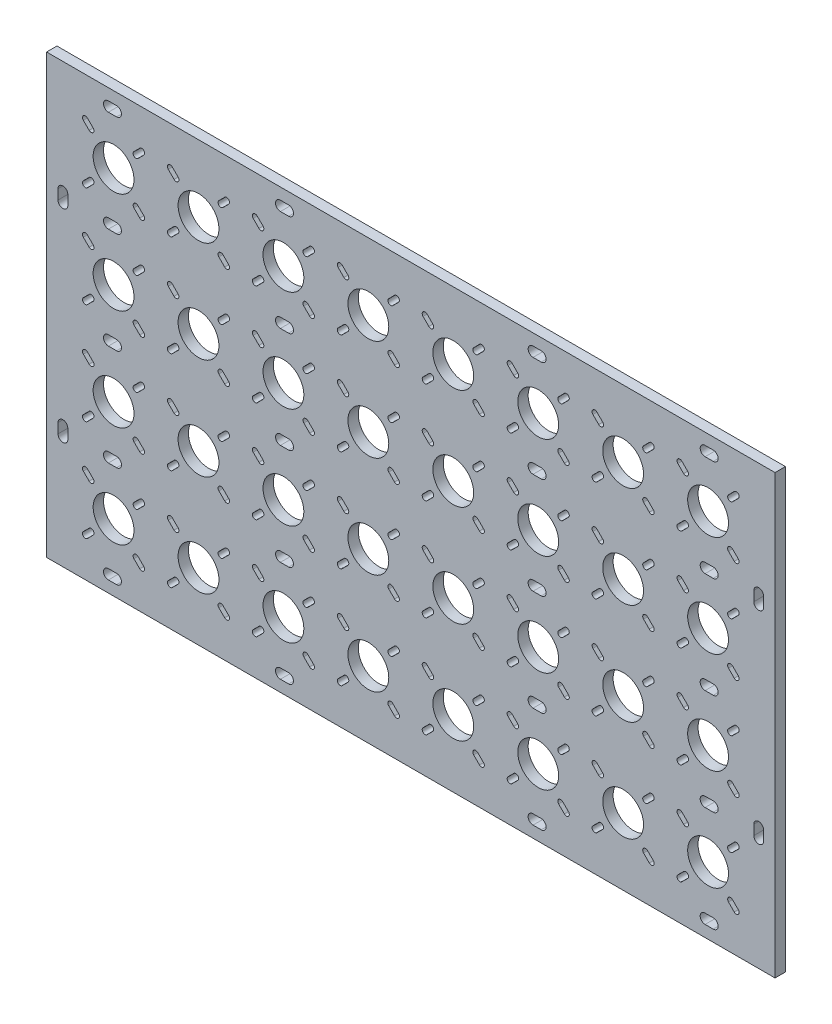
from build123d import *

# Parameters (mm, degrees)
SKETCH1_W           = 446
SKETCH1_H           = 268
SKETCH1_R           = 12.5
BOSS_EXTRUDE1_DEPTH = 6.35


with BuildPart() as part:
    # Sketch1 → Boss-Extrude1 (new body)
    with BuildSketch(Plane.XY):
        Rectangle(SKETCH1_W, SKETCH1_H)
        with Locations((-182, 93)):
            Circle(SKETCH1_R, mode=Mode.SUBTRACT)
        with Locations((-130, 93)):
            Circle(SKETCH1_R, mode=Mode.SUBTRACT)
        with Locations((-78, 93)):
            Circle(SKETCH1_R, mode=Mode.SUBTRACT)
        with Locations((-26, 93)):
            Circle(SKETCH1_R, mode=Mode.SUBTRACT)
        with Locations((26, 93)):
            Circle(SKETCH1_R, mode=Mode.SUBTRACT)
        with Locations((78, 93)):
            Circle(SKETCH1_R, mode=Mode.SUBTRACT)
        with Locations((130, 93)):
            Circle(SKETCH1_R, mode=Mode.SUBTRACT)
        with Locations((182, 93)):
            Circle(SKETCH1_R, mode=Mode.SUBTRACT)
        with Locations((-130, 31)):
            Circle(SKETCH1_R, mode=Mode.SUBTRACT)
        with Locations((-78, 31)):
            Circle(SKETCH1_R, mode=Mode.SUBTRACT)
        with Locations((-26, 31)):
            Circle(SKETCH1_R, mode=Mode.SUBTRACT)
        with Locations((26, 31)):
            Circle(SKETCH1_R, mode=Mode.SUBTRACT)
        with Locations((78, 31)):
            Circle(SKETCH1_R, mode=Mode.SUBTRACT)
        with Locations((130, 31)):
            Circle(SKETCH1_R, mode=Mode.SUBTRACT)
        with Locations((182, 31)):
            Circle(SKETCH1_R, mode=Mode.SUBTRACT)
        with Locations((-130, -31)):
            Circle(SKETCH1_R, mode=Mode.SUBTRACT)
        with Locations((-78, -31)):
            Circle(SKETCH1_R, mode=Mode.SUBTRACT)
        with Locations((-26, -31)):
            Circle(SKETCH1_R, mode=Mode.SUBTRACT)
        with Locations((26, -31)):
            Circle(SKETCH1_R, mode=Mode.SUBTRACT)
        with Locations((78, -31)):
            Circle(SKETCH1_R, mode=Mode.SUBTRACT)
        with Locations((130, -31)):
            Circle(SKETCH1_R, mode=Mode.SUBTRACT)
        with Locations((182, -31)):
            Circle(SKETCH1_R, mode=Mode.SUBTRACT)
        with Locations((-130, -93)):
            Circle(SKETCH1_R, mode=Mode.SUBTRACT)
        with Locations((-78, -93)):
            Circle(SKETCH1_R, mode=Mode.SUBTRACT)
        with Locations((-26, -93)):
            Circle(SKETCH1_R, mode=Mode.SUBTRACT)
        with Locations((26, -93)):
            Circle(SKETCH1_R, mode=Mode.SUBTRACT)
        with Locations((78, -93)):
            Circle(SKETCH1_R, mode=Mode.SUBTRACT)
        with Locations((130, -93)):
            Circle(SKETCH1_R, mode=Mode.SUBTRACT)
        with Locations((182, -93)):
            Circle(SKETCH1_R, mode=Mode.SUBTRACT)
        with Locations((-182, 31)):
            Circle(SKETCH1_R, mode=Mode.SUBTRACT)
        with Locations((-182, -31)):
            Circle(SKETCH1_R, mode=Mode.SUBTRACT)
        with Locations((-182, -93)):
            Circle(SKETCH1_R, mode=Mode.SUBTRACT)
        with BuildLine():
            Line((-198.030330086, 111.50520382), (-194.49479618, 107.969669914))
            ThreePointArc((-194.49479618, 107.969669914), (-194.49479618, 105.49479618), (-196.969669914, 105.49479618))
            Line((-196.969669914, 105.49479618), (-200.50520382, 109.030330086))
            ThreePointArc((-200.50520382, 109.030330086), (-200.50520382, 111.50520382), (-198.030330086, 111.50520382))
        make_face(mode=Mode.SUBTRACT)
        with BuildLine():
            Line((-163.49479618, 109.030330086), (-167.030330086, 105.49479618))
            ThreePointArc((-167.030330086, 105.49479618), (-169.50520382, 105.49479618), (-169.50520382, 107.969669914))
            Line((-169.50520382, 107.969669914), (-165.969669914, 111.50520382))
            ThreePointArc((-165.969669914, 111.50520382), (-163.49479618, 111.50520382), (-163.49479618, 109.030330086))
        make_face(mode=Mode.SUBTRACT)
        with BuildLine():
            Line((-165.969669914, 74.49479618), (-169.50520382, 78.030330086))
            ThreePointArc((-169.50520382, 78.030330086), (-169.50520382, 80.50520382), (-167.030330086, 80.50520382))
            Line((-167.030330086, 80.50520382), (-163.49479618, 76.969669914))
            ThreePointArc((-163.49479618, 76.969669914), (-163.49479618, 74.49479618), (-165.969669914, 74.49479618))
        make_face(mode=Mode.SUBTRACT)
        with BuildLine():
            Line((-200.50520382, 76.969669914), (-196.969669914, 80.50520382))
            ThreePointArc((-196.969669914, 80.50520382), (-194.49479618, 80.50520382), (-194.49479618, 78.030330086))
            Line((-194.49479618, 78.030330086), (-198.030330086, 74.49479618))
            ThreePointArc((-198.030330086, 74.49479618), (-200.50520382, 74.49479618), (-200.50520382, 76.969669914))
        make_face(mode=Mode.SUBTRACT)
        with BuildLine():
            Line((-146.030330086, 111.50520382), (-142.49479618, 107.969669914))
            ThreePointArc((-142.49479618, 107.969669914), (-142.49479618, 105.49479618), (-144.969669914, 105.49479618))
            Line((-144.969669914, 105.49479618), (-148.50520382, 109.030330086))
            ThreePointArc((-148.50520382, 109.030330086), (-148.50520382, 111.50520382), (-146.030330086, 111.50520382))
        make_face(mode=Mode.SUBTRACT)
        with BuildLine():
            Line((-111.49479618, 109.030330086), (-115.030330086, 105.49479618))
            ThreePointArc((-115.030330086, 105.49479618), (-117.50520382, 105.49479618), (-117.50520382, 107.969669914))
            Line((-117.50520382, 107.969669914), (-113.969669914, 111.50520382))
            ThreePointArc((-113.969669914, 111.50520382), (-111.49479618, 111.50520382), (-111.49479618, 109.030330086))
        make_face(mode=Mode.SUBTRACT)
        with BuildLine():
            Line((-113.969669914, 74.49479618), (-117.50520382, 78.030330086))
            ThreePointArc((-117.50520382, 78.030330086), (-117.50520382, 80.50520382), (-115.030330086, 80.50520382))
            Line((-115.030330086, 80.50520382), (-111.49479618, 76.969669914))
            ThreePointArc((-111.49479618, 76.969669914), (-111.49479618, 74.49479618), (-113.969669914, 74.49479618))
        make_face(mode=Mode.SUBTRACT)
        with BuildLine():
            Line((-148.50520382, 76.969669914), (-144.969669914, 80.50520382))
            ThreePointArc((-144.969669914, 80.50520382), (-142.49479618, 80.50520382), (-142.49479618, 78.030330086))
            Line((-142.49479618, 78.030330086), (-146.030330086, 74.49479618))
            ThreePointArc((-146.030330086, 74.49479618), (-148.50520382, 74.49479618), (-148.50520382, 76.969669914))
        make_face(mode=Mode.SUBTRACT)
        with BuildLine():
            Line((-94.030330086, 111.50520382), (-90.49479618, 107.969669914))
            ThreePointArc((-90.49479618, 107.969669914), (-90.49479618, 105.49479618), (-92.969669914, 105.49479618))
            Line((-92.969669914, 105.49479618), (-96.50520382, 109.030330086))
            ThreePointArc((-96.50520382, 109.030330086), (-96.50520382, 111.50520382), (-94.030330086, 111.50520382))
        make_face(mode=Mode.SUBTRACT)
        with BuildLine():
            Line((-59.49479618, 109.030330086), (-63.030330086, 105.49479618))
            ThreePointArc((-63.030330086, 105.49479618), (-65.50520382, 105.49479618), (-65.50520382, 107.969669914))
            Line((-65.50520382, 107.969669914), (-61.969669914, 111.50520382))
            ThreePointArc((-61.969669914, 111.50520382), (-59.49479618, 111.50520382), (-59.49479618, 109.030330086))
        make_face(mode=Mode.SUBTRACT)
        with BuildLine():
            Line((-61.969669914, 74.49479618), (-65.50520382, 78.030330086))
            ThreePointArc((-65.50520382, 78.030330086), (-65.50520382, 80.50520382), (-63.030330086, 80.50520382))
            Line((-63.030330086, 80.50520382), (-59.49479618, 76.969669914))
            ThreePointArc((-59.49479618, 76.969669914), (-59.49479618, 74.49479618), (-61.969669914, 74.49479618))
        make_face(mode=Mode.SUBTRACT)
        with BuildLine():
            Line((-96.50520382, 76.969669914), (-92.969669914, 80.50520382))
            ThreePointArc((-92.969669914, 80.50520382), (-90.49479618, 80.50520382), (-90.49479618, 78.030330086))
            Line((-90.49479618, 78.030330086), (-94.030330086, 74.49479618))
            ThreePointArc((-94.030330086, 74.49479618), (-96.50520382, 74.49479618), (-96.50520382, 76.969669914))
        make_face(mode=Mode.SUBTRACT)
        with BuildLine():
            Line((-42.030330086, 111.50520382), (-38.49479618, 107.969669914))
            ThreePointArc((-38.49479618, 107.969669914), (-38.49479618, 105.49479618), (-40.969669914, 105.49479618))
            Line((-40.969669914, 105.49479618), (-44.50520382, 109.030330086))
            ThreePointArc((-44.50520382, 109.030330086), (-44.50520382, 111.50520382), (-42.030330086, 111.50520382))
        make_face(mode=Mode.SUBTRACT)
        with BuildLine():
            Line((-7.49479618, 109.030330086), (-11.030330086, 105.49479618))
            ThreePointArc((-11.030330086, 105.49479618), (-13.50520382, 105.49479618), (-13.50520382, 107.969669914))
            Line((-13.50520382, 107.969669914), (-9.969669914, 111.50520382))
            ThreePointArc((-9.969669914, 111.50520382), (-7.49479618, 111.50520382), (-7.49479618, 109.030330086))
        make_face(mode=Mode.SUBTRACT)
        with BuildLine():
            Line((-9.969669914, 74.49479618), (-13.50520382, 78.030330086))
            ThreePointArc((-13.50520382, 78.030330086), (-13.50520382, 80.50520382), (-11.030330086, 80.50520382))
            Line((-11.030330086, 80.50520382), (-7.49479618, 76.969669914))
            ThreePointArc((-7.49479618, 76.969669914), (-7.49479618, 74.49479618), (-9.969669914, 74.49479618))
        make_face(mode=Mode.SUBTRACT)
        with BuildLine():
            Line((-44.50520382, 76.969669914), (-40.969669914, 80.50520382))
            ThreePointArc((-40.969669914, 80.50520382), (-38.49479618, 80.50520382), (-38.49479618, 78.030330086))
            Line((-38.49479618, 78.030330086), (-42.030330086, 74.49479618))
            ThreePointArc((-42.030330086, 74.49479618), (-44.50520382, 74.49479618), (-44.50520382, 76.969669914))
        make_face(mode=Mode.SUBTRACT)
        with BuildLine():
            Line((9.969669914, 111.50520382), (13.50520382, 107.969669914))
            ThreePointArc((13.50520382, 107.969669914), (13.50520382, 105.49479618), (11.030330086, 105.49479618))
            Line((11.030330086, 105.49479618), (7.49479618, 109.030330086))
            ThreePointArc((7.49479618, 109.030330086), (7.49479618, 111.50520382), (9.969669914, 111.50520382))
        make_face(mode=Mode.SUBTRACT)
        with BuildLine():
            Line((44.50520382, 109.030330086), (40.969669914, 105.49479618))
            ThreePointArc((40.969669914, 105.49479618), (38.49479618, 105.49479618), (38.49479618, 107.969669914))
            Line((38.49479618, 107.969669914), (42.030330086, 111.50520382))
            ThreePointArc((42.030330086, 111.50520382), (44.50520382, 111.50520382), (44.50520382, 109.030330086))
        make_face(mode=Mode.SUBTRACT)
        with BuildLine():
            Line((42.030330086, 74.49479618), (38.49479618, 78.030330086))
            ThreePointArc((38.49479618, 78.030330086), (38.49479618, 80.50520382), (40.969669914, 80.50520382))
            Line((40.969669914, 80.50520382), (44.50520382, 76.969669914))
            ThreePointArc((44.50520382, 76.969669914), (44.50520382, 74.49479618), (42.030330086, 74.49479618))
        make_face(mode=Mode.SUBTRACT)
        with BuildLine():
            Line((7.49479618, 76.969669914), (11.030330086, 80.50520382))
            ThreePointArc((11.030330086, 80.50520382), (13.50520382, 80.50520382), (13.50520382, 78.030330086))
            Line((13.50520382, 78.030330086), (9.969669914, 74.49479618))
            ThreePointArc((9.969669914, 74.49479618), (7.49479618, 74.49479618), (7.49479618, 76.969669914))
        make_face(mode=Mode.SUBTRACT)
        with BuildLine():
            Line((61.969669914, 111.50520382), (65.50520382, 107.969669914))
            ThreePointArc((65.50520382, 107.969669914), (65.50520382, 105.49479618), (63.030330086, 105.49479618))
            Line((63.030330086, 105.49479618), (59.49479618, 109.030330086))
            ThreePointArc((59.49479618, 109.030330086), (59.49479618, 111.50520382), (61.969669914, 111.50520382))
        make_face(mode=Mode.SUBTRACT)
        with BuildLine():
            Line((96.50520382, 109.030330086), (92.969669914, 105.49479618))
            ThreePointArc((92.969669914, 105.49479618), (90.49479618, 105.49479618), (90.49479618, 107.969669914))
            Line((90.49479618, 107.969669914), (94.030330086, 111.50520382))
            ThreePointArc((94.030330086, 111.50520382), (96.50520382, 111.50520382), (96.50520382, 109.030330086))
        make_face(mode=Mode.SUBTRACT)
        with BuildLine():
            Line((94.030330086, 74.49479618), (90.49479618, 78.030330086))
            ThreePointArc((90.49479618, 78.030330086), (90.49479618, 80.50520382), (92.969669914, 80.50520382))
            Line((92.969669914, 80.50520382), (96.50520382, 76.969669914))
            ThreePointArc((96.50520382, 76.969669914), (96.50520382, 74.49479618), (94.030330086, 74.49479618))
        make_face(mode=Mode.SUBTRACT)
        with BuildLine():
            Line((59.49479618, 76.969669914), (63.030330086, 80.50520382))
            ThreePointArc((63.030330086, 80.50520382), (65.50520382, 80.50520382), (65.50520382, 78.030330086))
            Line((65.50520382, 78.030330086), (61.969669914, 74.49479618))
            ThreePointArc((61.969669914, 74.49479618), (59.49479618, 74.49479618), (59.49479618, 76.969669914))
        make_face(mode=Mode.SUBTRACT)
        with BuildLine():
            Line((113.969669914, 111.50520382), (117.50520382, 107.969669914))
            ThreePointArc((117.50520382, 107.969669914), (117.50520382, 105.49479618), (115.030330086, 105.49479618))
            Line((115.030330086, 105.49479618), (111.49479618, 109.030330086))
            ThreePointArc((111.49479618, 109.030330086), (111.49479618, 111.50520382), (113.969669914, 111.50520382))
        make_face(mode=Mode.SUBTRACT)
        with BuildLine():
            Line((148.50520382, 109.030330086), (144.969669914, 105.49479618))
            ThreePointArc((144.969669914, 105.49479618), (142.49479618, 105.49479618), (142.49479618, 107.969669914))
            Line((142.49479618, 107.969669914), (146.030330086, 111.50520382))
            ThreePointArc((146.030330086, 111.50520382), (148.50520382, 111.50520382), (148.50520382, 109.030330086))
        make_face(mode=Mode.SUBTRACT)
        with BuildLine():
            Line((146.030330086, 74.49479618), (142.49479618, 78.030330086))
            ThreePointArc((142.49479618, 78.030330086), (142.49479618, 80.50520382), (144.969669914, 80.50520382))
            Line((144.969669914, 80.50520382), (148.50520382, 76.969669914))
            ThreePointArc((148.50520382, 76.969669914), (148.50520382, 74.49479618), (146.030330086, 74.49479618))
        make_face(mode=Mode.SUBTRACT)
        with BuildLine():
            Line((111.49479618, 76.969669914), (115.030330086, 80.50520382))
            ThreePointArc((115.030330086, 80.50520382), (117.50520382, 80.50520382), (117.50520382, 78.030330086))
            Line((117.50520382, 78.030330086), (113.969669914, 74.49479618))
            ThreePointArc((113.969669914, 74.49479618), (111.49479618, 74.49479618), (111.49479618, 76.969669914))
        make_face(mode=Mode.SUBTRACT)
        with BuildLine():
            Line((165.969669914, 111.50520382), (169.50520382, 107.969669914))
            ThreePointArc((169.50520382, 107.969669914), (169.50520382, 105.49479618), (167.030330086, 105.49479618))
            Line((167.030330086, 105.49479618), (163.49479618, 109.030330086))
            ThreePointArc((163.49479618, 109.030330086), (163.49479618, 111.50520382), (165.969669914, 111.50520382))
        make_face(mode=Mode.SUBTRACT)
        with BuildLine():
            Line((200.50520382, 109.030330086), (196.969669914, 105.49479618))
            ThreePointArc((196.969669914, 105.49479618), (194.49479618, 105.49479618), (194.49479618, 107.969669914))
            Line((194.49479618, 107.969669914), (198.030330086, 111.50520382))
            ThreePointArc((198.030330086, 111.50520382), (200.50520382, 111.50520382), (200.50520382, 109.030330086))
        make_face(mode=Mode.SUBTRACT)
        with BuildLine():
            Line((198.030330086, 74.49479618), (194.49479618, 78.030330086))
            ThreePointArc((194.49479618, 78.030330086), (194.49479618, 80.50520382), (196.969669914, 80.50520382))
            Line((196.969669914, 80.50520382), (200.50520382, 76.969669914))
            ThreePointArc((200.50520382, 76.969669914), (200.50520382, 74.49479618), (198.030330086, 74.49479618))
        make_face(mode=Mode.SUBTRACT)
        with BuildLine():
            Line((163.49479618, 76.969669914), (167.030330086, 80.50520382))
            ThreePointArc((167.030330086, 80.50520382), (169.50520382, 80.50520382), (169.50520382, 78.030330086))
            Line((169.50520382, 78.030330086), (165.969669914, 74.49479618))
            ThreePointArc((165.969669914, 74.49479618), (163.49479618, 74.49479618), (163.49479618, 76.969669914))
        make_face(mode=Mode.SUBTRACT)
        with BuildLine():
            Line((-146.030330086, 49.50520382), (-142.49479618, 45.969669914))
            ThreePointArc((-142.49479618, 45.969669914), (-142.49479618, 43.49479618), (-144.969669914, 43.49479618))
            Line((-144.969669914, 43.49479618), (-148.50520382, 47.030330086))
            ThreePointArc((-148.50520382, 47.030330086), (-148.50520382, 49.50520382), (-146.030330086, 49.50520382))
        make_face(mode=Mode.SUBTRACT)
        with BuildLine():
            Line((-111.49479618, 47.030330086), (-115.030330086, 43.49479618))
            ThreePointArc((-115.030330086, 43.49479618), (-117.50520382, 43.49479618), (-117.50520382, 45.969669914))
            Line((-117.50520382, 45.969669914), (-113.969669914, 49.50520382))
            ThreePointArc((-113.969669914, 49.50520382), (-111.49479618, 49.50520382), (-111.49479618, 47.030330086))
        make_face(mode=Mode.SUBTRACT)
        with BuildLine():
            Line((-113.969669914, 12.49479618), (-117.50520382, 16.030330086))
            ThreePointArc((-117.50520382, 16.030330086), (-117.50520382, 18.50520382), (-115.030330086, 18.50520382))
            Line((-115.030330086, 18.50520382), (-111.49479618, 14.969669914))
            ThreePointArc((-111.49479618, 14.969669914), (-111.49479618, 12.49479618), (-113.969669914, 12.49479618))
        make_face(mode=Mode.SUBTRACT)
        with BuildLine():
            Line((-148.50520382, 14.969669914), (-144.969669914, 18.50520382))
            ThreePointArc((-144.969669914, 18.50520382), (-142.49479618, 18.50520382), (-142.49479618, 16.030330086))
            Line((-142.49479618, 16.030330086), (-146.030330086, 12.49479618))
            ThreePointArc((-146.030330086, 12.49479618), (-148.50520382, 12.49479618), (-148.50520382, 14.969669914))
        make_face(mode=Mode.SUBTRACT)
        with BuildLine():
            Line((-94.030330086, 49.50520382), (-90.49479618, 45.969669914))
            ThreePointArc((-90.49479618, 45.969669914), (-90.49479618, 43.49479618), (-92.969669914, 43.49479618))
            Line((-92.969669914, 43.49479618), (-96.50520382, 47.030330086))
            ThreePointArc((-96.50520382, 47.030330086), (-96.50520382, 49.50520382), (-94.030330086, 49.50520382))
        make_face(mode=Mode.SUBTRACT)
        with BuildLine():
            Line((-59.49479618, 47.030330086), (-63.030330086, 43.49479618))
            ThreePointArc((-63.030330086, 43.49479618), (-65.50520382, 43.49479618), (-65.50520382, 45.969669914))
            Line((-65.50520382, 45.969669914), (-61.969669914, 49.50520382))
            ThreePointArc((-61.969669914, 49.50520382), (-59.49479618, 49.50520382), (-59.49479618, 47.030330086))
        make_face(mode=Mode.SUBTRACT)
        with BuildLine():
            Line((-61.969669914, 12.49479618), (-65.50520382, 16.030330086))
            ThreePointArc((-65.50520382, 16.030330086), (-65.50520382, 18.50520382), (-63.030330086, 18.50520382))
            Line((-63.030330086, 18.50520382), (-59.49479618, 14.969669914))
            ThreePointArc((-59.49479618, 14.969669914), (-59.49479618, 12.49479618), (-61.969669914, 12.49479618))
        make_face(mode=Mode.SUBTRACT)
        with BuildLine():
            Line((-96.50520382, 14.969669914), (-92.969669914, 18.50520382))
            ThreePointArc((-92.969669914, 18.50520382), (-90.49479618, 18.50520382), (-90.49479618, 16.030330086))
            Line((-90.49479618, 16.030330086), (-94.030330086, 12.49479618))
            ThreePointArc((-94.030330086, 12.49479618), (-96.50520382, 12.49479618), (-96.50520382, 14.969669914))
        make_face(mode=Mode.SUBTRACT)
        with BuildLine():
            Line((-42.030330086, 49.50520382), (-38.49479618, 45.969669914))
            ThreePointArc((-38.49479618, 45.969669914), (-38.49479618, 43.49479618), (-40.969669914, 43.49479618))
            Line((-40.969669914, 43.49479618), (-44.50520382, 47.030330086))
            ThreePointArc((-44.50520382, 47.030330086), (-44.50520382, 49.50520382), (-42.030330086, 49.50520382))
        make_face(mode=Mode.SUBTRACT)
        with BuildLine():
            Line((-7.49479618, 47.030330086), (-11.030330086, 43.49479618))
            ThreePointArc((-11.030330086, 43.49479618), (-13.50520382, 43.49479618), (-13.50520382, 45.969669914))
            Line((-13.50520382, 45.969669914), (-9.969669914, 49.50520382))
            ThreePointArc((-9.969669914, 49.50520382), (-7.49479618, 49.50520382), (-7.49479618, 47.030330086))
        make_face(mode=Mode.SUBTRACT)
        with BuildLine():
            Line((-9.969669914, 12.49479618), (-13.50520382, 16.030330086))
            ThreePointArc((-13.50520382, 16.030330086), (-13.50520382, 18.50520382), (-11.030330086, 18.50520382))
            Line((-11.030330086, 18.50520382), (-7.49479618, 14.969669914))
            ThreePointArc((-7.49479618, 14.969669914), (-7.49479618, 12.49479618), (-9.969669914, 12.49479618))
        make_face(mode=Mode.SUBTRACT)
        with BuildLine():
            Line((-44.50520382, 14.969669914), (-40.969669914, 18.50520382))
            ThreePointArc((-40.969669914, 18.50520382), (-38.49479618, 18.50520382), (-38.49479618, 16.030330086))
            Line((-38.49479618, 16.030330086), (-42.030330086, 12.49479618))
            ThreePointArc((-42.030330086, 12.49479618), (-44.50520382, 12.49479618), (-44.50520382, 14.969669914))
        make_face(mode=Mode.SUBTRACT)
        with BuildLine():
            Line((9.969669914, 49.50520382), (13.50520382, 45.969669914))
            ThreePointArc((13.50520382, 45.969669914), (13.50520382, 43.49479618), (11.030330086, 43.49479618))
            Line((11.030330086, 43.49479618), (7.49479618, 47.030330086))
            ThreePointArc((7.49479618, 47.030330086), (7.49479618, 49.50520382), (9.969669914, 49.50520382))
        make_face(mode=Mode.SUBTRACT)
        with BuildLine():
            Line((44.50520382, 47.030330086), (40.969669914, 43.49479618))
            ThreePointArc((40.969669914, 43.49479618), (38.49479618, 43.49479618), (38.49479618, 45.969669914))
            Line((38.49479618, 45.969669914), (42.030330086, 49.50520382))
            ThreePointArc((42.030330086, 49.50520382), (44.50520382, 49.50520382), (44.50520382, 47.030330086))
        make_face(mode=Mode.SUBTRACT)
        with BuildLine():
            Line((42.030330086, 12.49479618), (38.49479618, 16.030330086))
            ThreePointArc((38.49479618, 16.030330086), (38.49479618, 18.50520382), (40.969669914, 18.50520382))
            Line((40.969669914, 18.50520382), (44.50520382, 14.969669914))
            ThreePointArc((44.50520382, 14.969669914), (44.50520382, 12.49479618), (42.030330086, 12.49479618))
        make_face(mode=Mode.SUBTRACT)
        with BuildLine():
            Line((7.49479618, 14.969669914), (11.030330086, 18.50520382))
            ThreePointArc((11.030330086, 18.50520382), (13.50520382, 18.50520382), (13.50520382, 16.030330086))
            Line((13.50520382, 16.030330086), (9.969669914, 12.49479618))
            ThreePointArc((9.969669914, 12.49479618), (7.49479618, 12.49479618), (7.49479618, 14.969669914))
        make_face(mode=Mode.SUBTRACT)
        with BuildLine():
            Line((61.969669914, 49.50520382), (65.50520382, 45.969669914))
            ThreePointArc((65.50520382, 45.969669914), (65.50520382, 43.49479618), (63.030330086, 43.49479618))
            Line((63.030330086, 43.49479618), (59.49479618, 47.030330086))
            ThreePointArc((59.49479618, 47.030330086), (59.49479618, 49.50520382), (61.969669914, 49.50520382))
        make_face(mode=Mode.SUBTRACT)
        with BuildLine():
            Line((96.50520382, 47.030330086), (92.969669914, 43.49479618))
            ThreePointArc((92.969669914, 43.49479618), (90.49479618, 43.49479618), (90.49479618, 45.969669914))
            Line((90.49479618, 45.969669914), (94.030330086, 49.50520382))
            ThreePointArc((94.030330086, 49.50520382), (96.50520382, 49.50520382), (96.50520382, 47.030330086))
        make_face(mode=Mode.SUBTRACT)
        with BuildLine():
            Line((94.030330086, 12.49479618), (90.49479618, 16.030330086))
            ThreePointArc((90.49479618, 16.030330086), (90.49479618, 18.50520382), (92.969669914, 18.50520382))
            Line((92.969669914, 18.50520382), (96.50520382, 14.969669914))
            ThreePointArc((96.50520382, 14.969669914), (96.50520382, 12.49479618), (94.030330086, 12.49479618))
        make_face(mode=Mode.SUBTRACT)
        with BuildLine():
            Line((59.49479618, 14.969669914), (63.030330086, 18.50520382))
            ThreePointArc((63.030330086, 18.50520382), (65.50520382, 18.50520382), (65.50520382, 16.030330086))
            Line((65.50520382, 16.030330086), (61.969669914, 12.49479618))
            ThreePointArc((61.969669914, 12.49479618), (59.49479618, 12.49479618), (59.49479618, 14.969669914))
        make_face(mode=Mode.SUBTRACT)
        with BuildLine():
            Line((113.969669914, 49.50520382), (117.50520382, 45.969669914))
            ThreePointArc((117.50520382, 45.969669914), (117.50520382, 43.49479618), (115.030330086, 43.49479618))
            Line((115.030330086, 43.49479618), (111.49479618, 47.030330086))
            ThreePointArc((111.49479618, 47.030330086), (111.49479618, 49.50520382), (113.969669914, 49.50520382))
        make_face(mode=Mode.SUBTRACT)
        with BuildLine():
            Line((148.50520382, 47.030330086), (144.969669914, 43.49479618))
            ThreePointArc((144.969669914, 43.49479618), (142.49479618, 43.49479618), (142.49479618, 45.969669914))
            Line((142.49479618, 45.969669914), (146.030330086, 49.50520382))
            ThreePointArc((146.030330086, 49.50520382), (148.50520382, 49.50520382), (148.50520382, 47.030330086))
        make_face(mode=Mode.SUBTRACT)
        with BuildLine():
            Line((146.030330086, 12.49479618), (142.49479618, 16.030330086))
            ThreePointArc((142.49479618, 16.030330086), (142.49479618, 18.50520382), (144.969669914, 18.50520382))
            Line((144.969669914, 18.50520382), (148.50520382, 14.969669914))
            ThreePointArc((148.50520382, 14.969669914), (148.50520382, 12.49479618), (146.030330086, 12.49479618))
        make_face(mode=Mode.SUBTRACT)
        with BuildLine():
            Line((111.49479618, 14.969669914), (115.030330086, 18.50520382))
            ThreePointArc((115.030330086, 18.50520382), (117.50520382, 18.50520382), (117.50520382, 16.030330086))
            Line((117.50520382, 16.030330086), (113.969669914, 12.49479618))
            ThreePointArc((113.969669914, 12.49479618), (111.49479618, 12.49479618), (111.49479618, 14.969669914))
        make_face(mode=Mode.SUBTRACT)
        with BuildLine():
            Line((165.969669914, 49.50520382), (169.50520382, 45.969669914))
            ThreePointArc((169.50520382, 45.969669914), (169.50520382, 43.49479618), (167.030330086, 43.49479618))
            Line((167.030330086, 43.49479618), (163.49479618, 47.030330086))
            ThreePointArc((163.49479618, 47.030330086), (163.49479618, 49.50520382), (165.969669914, 49.50520382))
        make_face(mode=Mode.SUBTRACT)
        with BuildLine():
            Line((200.50520382, 47.030330086), (196.969669914, 43.49479618))
            ThreePointArc((196.969669914, 43.49479618), (194.49479618, 43.49479618), (194.49479618, 45.969669914))
            Line((194.49479618, 45.969669914), (198.030330086, 49.50520382))
            ThreePointArc((198.030330086, 49.50520382), (200.50520382, 49.50520382), (200.50520382, 47.030330086))
        make_face(mode=Mode.SUBTRACT)
        with BuildLine():
            Line((198.030330086, 12.49479618), (194.49479618, 16.030330086))
            ThreePointArc((194.49479618, 16.030330086), (194.49479618, 18.50520382), (196.969669914, 18.50520382))
            Line((196.969669914, 18.50520382), (200.50520382, 14.969669914))
            ThreePointArc((200.50520382, 14.969669914), (200.50520382, 12.49479618), (198.030330086, 12.49479618))
        make_face(mode=Mode.SUBTRACT)
        with BuildLine():
            Line((163.49479618, 14.969669914), (167.030330086, 18.50520382))
            ThreePointArc((167.030330086, 18.50520382), (169.50520382, 18.50520382), (169.50520382, 16.030330086))
            Line((169.50520382, 16.030330086), (165.969669914, 12.49479618))
            ThreePointArc((165.969669914, 12.49479618), (163.49479618, 12.49479618), (163.49479618, 14.969669914))
        make_face(mode=Mode.SUBTRACT)
        with BuildLine():
            Line((-146.030330086, -12.49479618), (-142.49479618, -16.030330086))
            ThreePointArc((-142.49479618, -16.030330086), (-142.49479618, -18.50520382), (-144.969669914, -18.50520382))
            Line((-144.969669914, -18.50520382), (-148.50520382, -14.969669914))
            ThreePointArc((-148.50520382, -14.969669914), (-148.50520382, -12.49479618), (-146.030330086, -12.49479618))
        make_face(mode=Mode.SUBTRACT)
        with BuildLine():
            Line((-111.49479618, -14.969669914), (-115.030330086, -18.50520382))
            ThreePointArc((-115.030330086, -18.50520382), (-117.50520382, -18.50520382), (-117.50520382, -16.030330086))
            Line((-117.50520382, -16.030330086), (-113.969669914, -12.49479618))
            ThreePointArc((-113.969669914, -12.49479618), (-111.49479618, -12.49479618), (-111.49479618, -14.969669914))
        make_face(mode=Mode.SUBTRACT)
        with BuildLine():
            Line((-113.969669914, -49.50520382), (-117.50520382, -45.969669914))
            ThreePointArc((-117.50520382, -45.969669914), (-117.50520382, -43.49479618), (-115.030330086, -43.49479618))
            Line((-115.030330086, -43.49479618), (-111.49479618, -47.030330086))
            ThreePointArc((-111.49479618, -47.030330086), (-111.49479618, -49.50520382), (-113.969669914, -49.50520382))
        make_face(mode=Mode.SUBTRACT)
        with BuildLine():
            Line((-148.50520382, -47.030330086), (-144.969669914, -43.49479618))
            ThreePointArc((-144.969669914, -43.49479618), (-142.49479618, -43.49479618), (-142.49479618, -45.969669914))
            Line((-142.49479618, -45.969669914), (-146.030330086, -49.50520382))
            ThreePointArc((-146.030330086, -49.50520382), (-148.50520382, -49.50520382), (-148.50520382, -47.030330086))
        make_face(mode=Mode.SUBTRACT)
        with BuildLine():
            Line((-94.030330086, -12.49479618), (-90.49479618, -16.030330086))
            ThreePointArc((-90.49479618, -16.030330086), (-90.49479618, -18.50520382), (-92.969669914, -18.50520382))
            Line((-92.969669914, -18.50520382), (-96.50520382, -14.969669914))
            ThreePointArc((-96.50520382, -14.969669914), (-96.50520382, -12.49479618), (-94.030330086, -12.49479618))
        make_face(mode=Mode.SUBTRACT)
        with BuildLine():
            Line((-59.49479618, -14.969669914), (-63.030330086, -18.50520382))
            ThreePointArc((-63.030330086, -18.50520382), (-65.50520382, -18.50520382), (-65.50520382, -16.030330086))
            Line((-65.50520382, -16.030330086), (-61.969669914, -12.49479618))
            ThreePointArc((-61.969669914, -12.49479618), (-59.49479618, -12.49479618), (-59.49479618, -14.969669914))
        make_face(mode=Mode.SUBTRACT)
        with BuildLine():
            Line((-61.969669914, -49.50520382), (-65.50520382, -45.969669914))
            ThreePointArc((-65.50520382, -45.969669914), (-65.50520382, -43.49479618), (-63.030330086, -43.49479618))
            Line((-63.030330086, -43.49479618), (-59.49479618, -47.030330086))
            ThreePointArc((-59.49479618, -47.030330086), (-59.49479618, -49.50520382), (-61.969669914, -49.50520382))
        make_face(mode=Mode.SUBTRACT)
        with BuildLine():
            Line((-96.50520382, -47.030330086), (-92.969669914, -43.49479618))
            ThreePointArc((-92.969669914, -43.49479618), (-90.49479618, -43.49479618), (-90.49479618, -45.969669914))
            Line((-90.49479618, -45.969669914), (-94.030330086, -49.50520382))
            ThreePointArc((-94.030330086, -49.50520382), (-96.50520382, -49.50520382), (-96.50520382, -47.030330086))
        make_face(mode=Mode.SUBTRACT)
        with BuildLine():
            Line((-42.030330086, -12.49479618), (-38.49479618, -16.030330086))
            ThreePointArc((-38.49479618, -16.030330086), (-38.49479618, -18.50520382), (-40.969669914, -18.50520382))
            Line((-40.969669914, -18.50520382), (-44.50520382, -14.969669914))
            ThreePointArc((-44.50520382, -14.969669914), (-44.50520382, -12.49479618), (-42.030330086, -12.49479618))
        make_face(mode=Mode.SUBTRACT)
        with BuildLine():
            Line((-7.49479618, -14.969669914), (-11.030330086, -18.50520382))
            ThreePointArc((-11.030330086, -18.50520382), (-13.50520382, -18.50520382), (-13.50520382, -16.030330086))
            Line((-13.50520382, -16.030330086), (-9.969669914, -12.49479618))
            ThreePointArc((-9.969669914, -12.49479618), (-7.49479618, -12.49479618), (-7.49479618, -14.969669914))
        make_face(mode=Mode.SUBTRACT)
        with BuildLine():
            Line((-9.969669914, -49.50520382), (-13.50520382, -45.969669914))
            ThreePointArc((-13.50520382, -45.969669914), (-13.50520382, -43.49479618), (-11.030330086, -43.49479618))
            Line((-11.030330086, -43.49479618), (-7.49479618, -47.030330086))
            ThreePointArc((-7.49479618, -47.030330086), (-7.49479618, -49.50520382), (-9.969669914, -49.50520382))
        make_face(mode=Mode.SUBTRACT)
        with BuildLine():
            Line((-44.50520382, -47.030330086), (-40.969669914, -43.49479618))
            ThreePointArc((-40.969669914, -43.49479618), (-38.49479618, -43.49479618), (-38.49479618, -45.969669914))
            Line((-38.49479618, -45.969669914), (-42.030330086, -49.50520382))
            ThreePointArc((-42.030330086, -49.50520382), (-44.50520382, -49.50520382), (-44.50520382, -47.030330086))
        make_face(mode=Mode.SUBTRACT)
        with BuildLine():
            Line((9.969669914, -12.49479618), (13.50520382, -16.030330086))
            ThreePointArc((13.50520382, -16.030330086), (13.50520382, -18.50520382), (11.030330086, -18.50520382))
            Line((11.030330086, -18.50520382), (7.49479618, -14.969669914))
            ThreePointArc((7.49479618, -14.969669914), (7.49479618, -12.49479618), (9.969669914, -12.49479618))
        make_face(mode=Mode.SUBTRACT)
        with BuildLine():
            Line((44.50520382, -14.969669914), (40.969669914, -18.50520382))
            ThreePointArc((40.969669914, -18.50520382), (38.49479618, -18.50520382), (38.49479618, -16.030330086))
            Line((38.49479618, -16.030330086), (42.030330086, -12.49479618))
            ThreePointArc((42.030330086, -12.49479618), (44.50520382, -12.49479618), (44.50520382, -14.969669914))
        make_face(mode=Mode.SUBTRACT)
        with BuildLine():
            Line((42.030330086, -49.50520382), (38.49479618, -45.969669914))
            ThreePointArc((38.49479618, -45.969669914), (38.49479618, -43.49479618), (40.969669914, -43.49479618))
            Line((40.969669914, -43.49479618), (44.50520382, -47.030330086))
            ThreePointArc((44.50520382, -47.030330086), (44.50520382, -49.50520382), (42.030330086, -49.50520382))
        make_face(mode=Mode.SUBTRACT)
        with BuildLine():
            Line((7.49479618, -47.030330086), (11.030330086, -43.49479618))
            ThreePointArc((11.030330086, -43.49479618), (13.50520382, -43.49479618), (13.50520382, -45.969669914))
            Line((13.50520382, -45.969669914), (9.969669914, -49.50520382))
            ThreePointArc((9.969669914, -49.50520382), (7.49479618, -49.50520382), (7.49479618, -47.030330086))
        make_face(mode=Mode.SUBTRACT)
        with BuildLine():
            Line((61.969669914, -12.49479618), (65.50520382, -16.030330086))
            ThreePointArc((65.50520382, -16.030330086), (65.50520382, -18.50520382), (63.030330086, -18.50520382))
            Line((63.030330086, -18.50520382), (59.49479618, -14.969669914))
            ThreePointArc((59.49479618, -14.969669914), (59.49479618, -12.49479618), (61.969669914, -12.49479618))
        make_face(mode=Mode.SUBTRACT)
        with BuildLine():
            Line((96.50520382, -14.969669914), (92.969669914, -18.50520382))
            ThreePointArc((92.969669914, -18.50520382), (90.49479618, -18.50520382), (90.49479618, -16.030330086))
            Line((90.49479618, -16.030330086), (94.030330086, -12.49479618))
            ThreePointArc((94.030330086, -12.49479618), (96.50520382, -12.49479618), (96.50520382, -14.969669914))
        make_face(mode=Mode.SUBTRACT)
        with BuildLine():
            Line((94.030330086, -49.50520382), (90.49479618, -45.969669914))
            ThreePointArc((90.49479618, -45.969669914), (90.49479618, -43.49479618), (92.969669914, -43.49479618))
            Line((92.969669914, -43.49479618), (96.50520382, -47.030330086))
            ThreePointArc((96.50520382, -47.030330086), (96.50520382, -49.50520382), (94.030330086, -49.50520382))
        make_face(mode=Mode.SUBTRACT)
        with BuildLine():
            Line((59.49479618, -47.030330086), (63.030330086, -43.49479618))
            ThreePointArc((63.030330086, -43.49479618), (65.50520382, -43.49479618), (65.50520382, -45.969669914))
            Line((65.50520382, -45.969669914), (61.969669914, -49.50520382))
            ThreePointArc((61.969669914, -49.50520382), (59.49479618, -49.50520382), (59.49479618, -47.030330086))
        make_face(mode=Mode.SUBTRACT)
        with BuildLine():
            Line((113.969669914, -12.49479618), (117.50520382, -16.030330086))
            ThreePointArc((117.50520382, -16.030330086), (117.50520382, -18.50520382), (115.030330086, -18.50520382))
            Line((115.030330086, -18.50520382), (111.49479618, -14.969669914))
            ThreePointArc((111.49479618, -14.969669914), (111.49479618, -12.49479618), (113.969669914, -12.49479618))
        make_face(mode=Mode.SUBTRACT)
        with BuildLine():
            Line((148.50520382, -14.969669914), (144.969669914, -18.50520382))
            ThreePointArc((144.969669914, -18.50520382), (142.49479618, -18.50520382), (142.49479618, -16.030330086))
            Line((142.49479618, -16.030330086), (146.030330086, -12.49479618))
            ThreePointArc((146.030330086, -12.49479618), (148.50520382, -12.49479618), (148.50520382, -14.969669914))
        make_face(mode=Mode.SUBTRACT)
        with BuildLine():
            Line((146.030330086, -49.50520382), (142.49479618, -45.969669914))
            ThreePointArc((142.49479618, -45.969669914), (142.49479618, -43.49479618), (144.969669914, -43.49479618))
            Line((144.969669914, -43.49479618), (148.50520382, -47.030330086))
            ThreePointArc((148.50520382, -47.030330086), (148.50520382, -49.50520382), (146.030330086, -49.50520382))
        make_face(mode=Mode.SUBTRACT)
        with BuildLine():
            Line((111.49479618, -47.030330086), (115.030330086, -43.49479618))
            ThreePointArc((115.030330086, -43.49479618), (117.50520382, -43.49479618), (117.50520382, -45.969669914))
            Line((117.50520382, -45.969669914), (113.969669914, -49.50520382))
            ThreePointArc((113.969669914, -49.50520382), (111.49479618, -49.50520382), (111.49479618, -47.030330086))
        make_face(mode=Mode.SUBTRACT)
        with BuildLine():
            Line((165.969669914, -12.49479618), (169.50520382, -16.030330086))
            ThreePointArc((169.50520382, -16.030330086), (169.50520382, -18.50520382), (167.030330086, -18.50520382))
            Line((167.030330086, -18.50520382), (163.49479618, -14.969669914))
            ThreePointArc((163.49479618, -14.969669914), (163.49479618, -12.49479618), (165.969669914, -12.49479618))
        make_face(mode=Mode.SUBTRACT)
        with BuildLine():
            Line((200.50520382, -14.969669914), (196.969669914, -18.50520382))
            ThreePointArc((196.969669914, -18.50520382), (194.49479618, -18.50520382), (194.49479618, -16.030330086))
            Line((194.49479618, -16.030330086), (198.030330086, -12.49479618))
            ThreePointArc((198.030330086, -12.49479618), (200.50520382, -12.49479618), (200.50520382, -14.969669914))
        make_face(mode=Mode.SUBTRACT)
        with BuildLine():
            Line((198.030330086, -49.50520382), (194.49479618, -45.969669914))
            ThreePointArc((194.49479618, -45.969669914), (194.49479618, -43.49479618), (196.969669914, -43.49479618))
            Line((196.969669914, -43.49479618), (200.50520382, -47.030330086))
            ThreePointArc((200.50520382, -47.030330086), (200.50520382, -49.50520382), (198.030330086, -49.50520382))
        make_face(mode=Mode.SUBTRACT)
        with BuildLine():
            Line((163.49479618, -47.030330086), (167.030330086, -43.49479618))
            ThreePointArc((167.030330086, -43.49479618), (169.50520382, -43.49479618), (169.50520382, -45.969669914))
            Line((169.50520382, -45.969669914), (165.969669914, -49.50520382))
            ThreePointArc((165.969669914, -49.50520382), (163.49479618, -49.50520382), (163.49479618, -47.030330086))
        make_face(mode=Mode.SUBTRACT)
        with BuildLine():
            Line((-146.030330086, -74.49479618), (-142.49479618, -78.030330086))
            ThreePointArc((-142.49479618, -78.030330086), (-142.49479618, -80.50520382), (-144.969669914, -80.50520382))
            Line((-144.969669914, -80.50520382), (-148.50520382, -76.969669914))
            ThreePointArc((-148.50520382, -76.969669914), (-148.50520382, -74.49479618), (-146.030330086, -74.49479618))
        make_face(mode=Mode.SUBTRACT)
        with BuildLine():
            Line((-111.49479618, -76.969669914), (-115.030330086, -80.50520382))
            ThreePointArc((-115.030330086, -80.50520382), (-117.50520382, -80.50520382), (-117.50520382, -78.030330086))
            Line((-117.50520382, -78.030330086), (-113.969669914, -74.49479618))
            ThreePointArc((-113.969669914, -74.49479618), (-111.49479618, -74.49479618), (-111.49479618, -76.969669914))
        make_face(mode=Mode.SUBTRACT)
        with BuildLine():
            Line((-113.969669914, -111.50520382), (-117.50520382, -107.969669914))
            ThreePointArc((-117.50520382, -107.969669914), (-117.50520382, -105.49479618), (-115.030330086, -105.49479618))
            Line((-115.030330086, -105.49479618), (-111.49479618, -109.030330086))
            ThreePointArc((-111.49479618, -109.030330086), (-111.49479618, -111.50520382), (-113.969669914, -111.50520382))
        make_face(mode=Mode.SUBTRACT)
        with BuildLine():
            Line((-148.50520382, -109.030330086), (-144.969669914, -105.49479618))
            ThreePointArc((-144.969669914, -105.49479618), (-142.49479618, -105.49479618), (-142.49479618, -107.969669914))
            Line((-142.49479618, -107.969669914), (-146.030330086, -111.50520382))
            ThreePointArc((-146.030330086, -111.50520382), (-148.50520382, -111.50520382), (-148.50520382, -109.030330086))
        make_face(mode=Mode.SUBTRACT)
        with BuildLine():
            Line((-94.030330086, -74.49479618), (-90.49479618, -78.030330086))
            ThreePointArc((-90.49479618, -78.030330086), (-90.49479618, -80.50520382), (-92.969669914, -80.50520382))
            Line((-92.969669914, -80.50520382), (-96.50520382, -76.969669914))
            ThreePointArc((-96.50520382, -76.969669914), (-96.50520382, -74.49479618), (-94.030330086, -74.49479618))
        make_face(mode=Mode.SUBTRACT)
        with BuildLine():
            Line((-59.49479618, -76.969669914), (-63.030330086, -80.50520382))
            ThreePointArc((-63.030330086, -80.50520382), (-65.50520382, -80.50520382), (-65.50520382, -78.030330086))
            Line((-65.50520382, -78.030330086), (-61.969669914, -74.49479618))
            ThreePointArc((-61.969669914, -74.49479618), (-59.49479618, -74.49479618), (-59.49479618, -76.969669914))
        make_face(mode=Mode.SUBTRACT)
        with BuildLine():
            Line((-61.969669914, -111.50520382), (-65.50520382, -107.969669914))
            ThreePointArc((-65.50520382, -107.969669914), (-65.50520382, -105.49479618), (-63.030330086, -105.49479618))
            Line((-63.030330086, -105.49479618), (-59.49479618, -109.030330086))
            ThreePointArc((-59.49479618, -109.030330086), (-59.49479618, -111.50520382), (-61.969669914, -111.50520382))
        make_face(mode=Mode.SUBTRACT)
        with BuildLine():
            Line((-96.50520382, -109.030330086), (-92.969669914, -105.49479618))
            ThreePointArc((-92.969669914, -105.49479618), (-90.49479618, -105.49479618), (-90.49479618, -107.969669914))
            Line((-90.49479618, -107.969669914), (-94.030330086, -111.50520382))
            ThreePointArc((-94.030330086, -111.50520382), (-96.50520382, -111.50520382), (-96.50520382, -109.030330086))
        make_face(mode=Mode.SUBTRACT)
        with BuildLine():
            Line((-42.030330086, -74.49479618), (-38.49479618, -78.030330086))
            ThreePointArc((-38.49479618, -78.030330086), (-38.49479618, -80.50520382), (-40.969669914, -80.50520382))
            Line((-40.969669914, -80.50520382), (-44.50520382, -76.969669914))
            ThreePointArc((-44.50520382, -76.969669914), (-44.50520382, -74.49479618), (-42.030330086, -74.49479618))
        make_face(mode=Mode.SUBTRACT)
        with BuildLine():
            Line((-7.49479618, -76.969669914), (-11.030330086, -80.50520382))
            ThreePointArc((-11.030330086, -80.50520382), (-13.50520382, -80.50520382), (-13.50520382, -78.030330086))
            Line((-13.50520382, -78.030330086), (-9.969669914, -74.49479618))
            ThreePointArc((-9.969669914, -74.49479618), (-7.49479618, -74.49479618), (-7.49479618, -76.969669914))
        make_face(mode=Mode.SUBTRACT)
        with BuildLine():
            Line((-9.969669914, -111.50520382), (-13.50520382, -107.969669914))
            ThreePointArc((-13.50520382, -107.969669914), (-13.50520382, -105.49479618), (-11.030330086, -105.49479618))
            Line((-11.030330086, -105.49479618), (-7.49479618, -109.030330086))
            ThreePointArc((-7.49479618, -109.030330086), (-7.49479618, -111.50520382), (-9.969669914, -111.50520382))
        make_face(mode=Mode.SUBTRACT)
        with BuildLine():
            Line((-44.50520382, -109.030330086), (-40.969669914, -105.49479618))
            ThreePointArc((-40.969669914, -105.49479618), (-38.49479618, -105.49479618), (-38.49479618, -107.969669914))
            Line((-38.49479618, -107.969669914), (-42.030330086, -111.50520382))
            ThreePointArc((-42.030330086, -111.50520382), (-44.50520382, -111.50520382), (-44.50520382, -109.030330086))
        make_face(mode=Mode.SUBTRACT)
        with BuildLine():
            Line((9.969669914, -74.49479618), (13.50520382, -78.030330086))
            ThreePointArc((13.50520382, -78.030330086), (13.50520382, -80.50520382), (11.030330086, -80.50520382))
            Line((11.030330086, -80.50520382), (7.49479618, -76.969669914))
            ThreePointArc((7.49479618, -76.969669914), (7.49479618, -74.49479618), (9.969669914, -74.49479618))
        make_face(mode=Mode.SUBTRACT)
        with BuildLine():
            Line((44.50520382, -76.969669914), (40.969669914, -80.50520382))
            ThreePointArc((40.969669914, -80.50520382), (38.49479618, -80.50520382), (38.49479618, -78.030330086))
            Line((38.49479618, -78.030330086), (42.030330086, -74.49479618))
            ThreePointArc((42.030330086, -74.49479618), (44.50520382, -74.49479618), (44.50520382, -76.969669914))
        make_face(mode=Mode.SUBTRACT)
        with BuildLine():
            Line((42.030330086, -111.50520382), (38.49479618, -107.969669914))
            ThreePointArc((38.49479618, -107.969669914), (38.49479618, -105.49479618), (40.969669914, -105.49479618))
            Line((40.969669914, -105.49479618), (44.50520382, -109.030330086))
            ThreePointArc((44.50520382, -109.030330086), (44.50520382, -111.50520382), (42.030330086, -111.50520382))
        make_face(mode=Mode.SUBTRACT)
        with BuildLine():
            Line((7.49479618, -109.030330086), (11.030330086, -105.49479618))
            ThreePointArc((11.030330086, -105.49479618), (13.50520382, -105.49479618), (13.50520382, -107.969669914))
            Line((13.50520382, -107.969669914), (9.969669914, -111.50520382))
            ThreePointArc((9.969669914, -111.50520382), (7.49479618, -111.50520382), (7.49479618, -109.030330086))
        make_face(mode=Mode.SUBTRACT)
        with BuildLine():
            Line((61.969669914, -74.49479618), (65.50520382, -78.030330086))
            ThreePointArc((65.50520382, -78.030330086), (65.50520382, -80.50520382), (63.030330086, -80.50520382))
            Line((63.030330086, -80.50520382), (59.49479618, -76.969669914))
            ThreePointArc((59.49479618, -76.969669914), (59.49479618, -74.49479618), (61.969669914, -74.49479618))
        make_face(mode=Mode.SUBTRACT)
        with BuildLine():
            Line((96.50520382, -76.969669914), (92.969669914, -80.50520382))
            ThreePointArc((92.969669914, -80.50520382), (90.49479618, -80.50520382), (90.49479618, -78.030330086))
            Line((90.49479618, -78.030330086), (94.030330086, -74.49479618))
            ThreePointArc((94.030330086, -74.49479618), (96.50520382, -74.49479618), (96.50520382, -76.969669914))
        make_face(mode=Mode.SUBTRACT)
        with BuildLine():
            Line((94.030330086, -111.50520382), (90.49479618, -107.969669914))
            ThreePointArc((90.49479618, -107.969669914), (90.49479618, -105.49479618), (92.969669914, -105.49479618))
            Line((92.969669914, -105.49479618), (96.50520382, -109.030330086))
            ThreePointArc((96.50520382, -109.030330086), (96.50520382, -111.50520382), (94.030330086, -111.50520382))
        make_face(mode=Mode.SUBTRACT)
        with BuildLine():
            Line((59.49479618, -109.030330086), (63.030330086, -105.49479618))
            ThreePointArc((63.030330086, -105.49479618), (65.50520382, -105.49479618), (65.50520382, -107.969669914))
            Line((65.50520382, -107.969669914), (61.969669914, -111.50520382))
            ThreePointArc((61.969669914, -111.50520382), (59.49479618, -111.50520382), (59.49479618, -109.030330086))
        make_face(mode=Mode.SUBTRACT)
        with BuildLine():
            Line((113.969669914, -74.49479618), (117.50520382, -78.030330086))
            ThreePointArc((117.50520382, -78.030330086), (117.50520382, -80.50520382), (115.030330086, -80.50520382))
            Line((115.030330086, -80.50520382), (111.49479618, -76.969669914))
            ThreePointArc((111.49479618, -76.969669914), (111.49479618, -74.49479618), (113.969669914, -74.49479618))
        make_face(mode=Mode.SUBTRACT)
        with BuildLine():
            Line((148.50520382, -76.969669914), (144.969669914, -80.50520382))
            ThreePointArc((144.969669914, -80.50520382), (142.49479618, -80.50520382), (142.49479618, -78.030330086))
            Line((142.49479618, -78.030330086), (146.030330086, -74.49479618))
            ThreePointArc((146.030330086, -74.49479618), (148.50520382, -74.49479618), (148.50520382, -76.969669914))
        make_face(mode=Mode.SUBTRACT)
        with BuildLine():
            Line((146.030330086, -111.50520382), (142.49479618, -107.969669914))
            ThreePointArc((142.49479618, -107.969669914), (142.49479618, -105.49479618), (144.969669914, -105.49479618))
            Line((144.969669914, -105.49479618), (148.50520382, -109.030330086))
            ThreePointArc((148.50520382, -109.030330086), (148.50520382, -111.50520382), (146.030330086, -111.50520382))
        make_face(mode=Mode.SUBTRACT)
        with BuildLine():
            Line((111.49479618, -109.030330086), (115.030330086, -105.49479618))
            ThreePointArc((115.030330086, -105.49479618), (117.50520382, -105.49479618), (117.50520382, -107.969669914))
            Line((117.50520382, -107.969669914), (113.969669914, -111.50520382))
            ThreePointArc((113.969669914, -111.50520382), (111.49479618, -111.50520382), (111.49479618, -109.030330086))
        make_face(mode=Mode.SUBTRACT)
        with BuildLine():
            Line((165.969669914, -74.49479618), (169.50520382, -78.030330086))
            ThreePointArc((169.50520382, -78.030330086), (169.50520382, -80.50520382), (167.030330086, -80.50520382))
            Line((167.030330086, -80.50520382), (163.49479618, -76.969669914))
            ThreePointArc((163.49479618, -76.969669914), (163.49479618, -74.49479618), (165.969669914, -74.49479618))
        make_face(mode=Mode.SUBTRACT)
        with BuildLine():
            Line((200.50520382, -76.969669914), (196.969669914, -80.50520382))
            ThreePointArc((196.969669914, -80.50520382), (194.49479618, -80.50520382), (194.49479618, -78.030330086))
            Line((194.49479618, -78.030330086), (198.030330086, -74.49479618))
            ThreePointArc((198.030330086, -74.49479618), (200.50520382, -74.49479618), (200.50520382, -76.969669914))
        make_face(mode=Mode.SUBTRACT)
        with BuildLine():
            Line((198.030330086, -111.50520382), (194.49479618, -107.969669914))
            ThreePointArc((194.49479618, -107.969669914), (194.49479618, -105.49479618), (196.969669914, -105.49479618))
            Line((196.969669914, -105.49479618), (200.50520382, -109.030330086))
            ThreePointArc((200.50520382, -109.030330086), (200.50520382, -111.50520382), (198.030330086, -111.50520382))
        make_face(mode=Mode.SUBTRACT)
        with BuildLine():
            Line((163.49479618, -109.030330086), (167.030330086, -105.49479618))
            ThreePointArc((167.030330086, -105.49479618), (169.50520382, -105.49479618), (169.50520382, -107.969669914))
            Line((169.50520382, -107.969669914), (165.969669914, -111.50520382))
            ThreePointArc((165.969669914, -111.50520382), (163.49479618, -111.50520382), (163.49479618, -109.030330086))
        make_face(mode=Mode.SUBTRACT)
        with BuildLine():
            Line((-198.030330086, 49.50520382), (-194.49479618, 45.969669914))
            ThreePointArc((-194.49479618, 45.969669914), (-194.49479618, 43.49479618), (-196.969669914, 43.49479618))
            Line((-196.969669914, 43.49479618), (-200.50520382, 47.030330086))
            ThreePointArc((-200.50520382, 47.030330086), (-200.50520382, 49.50520382), (-198.030330086, 49.50520382))
        make_face(mode=Mode.SUBTRACT)
        with BuildLine():
            Line((-163.49479618, 47.030330086), (-167.030330086, 43.49479618))
            ThreePointArc((-167.030330086, 43.49479618), (-169.50520382, 43.49479618), (-169.50520382, 45.969669914))
            Line((-169.50520382, 45.969669914), (-165.969669914, 49.50520382))
            ThreePointArc((-165.969669914, 49.50520382), (-163.49479618, 49.50520382), (-163.49479618, 47.030330086))
        make_face(mode=Mode.SUBTRACT)
        with BuildLine():
            Line((-165.969669914, 12.49479618), (-169.50520382, 16.030330086))
            ThreePointArc((-169.50520382, 16.030330086), (-169.50520382, 18.50520382), (-167.030330086, 18.50520382))
            Line((-167.030330086, 18.50520382), (-163.49479618, 14.969669914))
            ThreePointArc((-163.49479618, 14.969669914), (-163.49479618, 12.49479618), (-165.969669914, 12.49479618))
        make_face(mode=Mode.SUBTRACT)
        with BuildLine():
            Line((-200.50520382, 14.969669914), (-196.969669914, 18.50520382))
            ThreePointArc((-196.969669914, 18.50520382), (-194.49479618, 18.50520382), (-194.49479618, 16.030330086))
            Line((-194.49479618, 16.030330086), (-198.030330086, 12.49479618))
            ThreePointArc((-198.030330086, 12.49479618), (-200.50520382, 12.49479618), (-200.50520382, 14.969669914))
        make_face(mode=Mode.SUBTRACT)
        with BuildLine():
            Line((-198.030330086, -12.49479618), (-194.49479618, -16.030330086))
            ThreePointArc((-194.49479618, -16.030330086), (-194.49479618, -18.50520382), (-196.969669914, -18.50520382))
            Line((-196.969669914, -18.50520382), (-200.50520382, -14.969669914))
            ThreePointArc((-200.50520382, -14.969669914), (-200.50520382, -12.49479618), (-198.030330086, -12.49479618))
        make_face(mode=Mode.SUBTRACT)
        with BuildLine():
            Line((-163.49479618, -14.969669914), (-167.030330086, -18.50520382))
            ThreePointArc((-167.030330086, -18.50520382), (-169.50520382, -18.50520382), (-169.50520382, -16.030330086))
            Line((-169.50520382, -16.030330086), (-165.969669914, -12.49479618))
            ThreePointArc((-165.969669914, -12.49479618), (-163.49479618, -12.49479618), (-163.49479618, -14.969669914))
        make_face(mode=Mode.SUBTRACT)
        with BuildLine():
            Line((-165.969669914, -49.50520382), (-169.50520382, -45.969669914))
            ThreePointArc((-169.50520382, -45.969669914), (-169.50520382, -43.49479618), (-167.030330086, -43.49479618))
            Line((-167.030330086, -43.49479618), (-163.49479618, -47.030330086))
            ThreePointArc((-163.49479618, -47.030330086), (-163.49479618, -49.50520382), (-165.969669914, -49.50520382))
        make_face(mode=Mode.SUBTRACT)
        with BuildLine():
            Line((-200.50520382, -47.030330086), (-196.969669914, -43.49479618))
            ThreePointArc((-196.969669914, -43.49479618), (-194.49479618, -43.49479618), (-194.49479618, -45.969669914))
            Line((-194.49479618, -45.969669914), (-198.030330086, -49.50520382))
            ThreePointArc((-198.030330086, -49.50520382), (-200.50520382, -49.50520382), (-200.50520382, -47.030330086))
        make_face(mode=Mode.SUBTRACT)
        with BuildLine():
            Line((-198.030330086, -74.49479618), (-194.49479618, -78.030330086))
            ThreePointArc((-194.49479618, -78.030330086), (-194.49479618, -80.50520382), (-196.969669914, -80.50520382))
            Line((-196.969669914, -80.50520382), (-200.50520382, -76.969669914))
            ThreePointArc((-200.50520382, -76.969669914), (-200.50520382, -74.49479618), (-198.030330086, -74.49479618))
        make_face(mode=Mode.SUBTRACT)
        with BuildLine():
            Line((-163.49479618, -76.969669914), (-167.030330086, -80.50520382))
            ThreePointArc((-167.030330086, -80.50520382), (-169.50520382, -80.50520382), (-169.50520382, -78.030330086))
            Line((-169.50520382, -78.030330086), (-165.969669914, -74.49479618))
            ThreePointArc((-165.969669914, -74.49479618), (-163.49479618, -74.49479618), (-163.49479618, -76.969669914))
        make_face(mode=Mode.SUBTRACT)
        with BuildLine():
            Line((-165.969669914, -111.50520382), (-169.50520382, -107.969669914))
            ThreePointArc((-169.50520382, -107.969669914), (-169.50520382, -105.49479618), (-167.030330086, -105.49479618))
            Line((-167.030330086, -105.49479618), (-163.49479618, -109.030330086))
            ThreePointArc((-163.49479618, -109.030330086), (-163.49479618, -111.50520382), (-165.969669914, -111.50520382))
        make_face(mode=Mode.SUBTRACT)
        with BuildLine():
            Line((-200.50520382, -109.030330086), (-196.969669914, -105.49479618))
            ThreePointArc((-196.969669914, -105.49479618), (-194.49479618, -105.49479618), (-194.49479618, -107.969669914))
            Line((-194.49479618, -107.969669914), (-198.030330086, -111.50520382))
            ThreePointArc((-198.030330086, -111.50520382), (-200.50520382, -111.50520382), (-200.50520382, -109.030330086))
        make_face(mode=Mode.SUBTRACT)
        with BuildLine():
            Line((-185.164470022, 127), (-180.164470022, 127))
            ThreePointArc((-180.164470022, 127), (-177.164470022, 124), (-180.164470022, 121))
            Line((-180.164470022, 121), (-185.164470022, 121))
            ThreePointArc((-185.164470022, 121), (-188.164470022, 124), (-185.164470022, 127))
        make_face(mode=Mode.SUBTRACT)
        with BuildLine():
            Line((-74.835529978, 127), (-79.835529978, 127))
            ThreePointArc((-79.835529978, 127), (-82.835529978, 124), (-79.835529978, 121))
            Line((-79.835529978, 121), (-74.835529978, 121))
            ThreePointArc((-74.835529978, 121), (-71.835529978, 124), (-74.835529978, 127))
        make_face(mode=Mode.SUBTRACT)
        with BuildLine():
            Line((74.835529978, 127), (79.835529978, 127))
            ThreePointArc((79.835529978, 127), (82.835529978, 124), (79.835529978, 121))
            Line((79.835529978, 121), (74.835529978, 121))
            ThreePointArc((74.835529978, 121), (71.835529978, 124), (74.835529978, 127))
        make_face(mode=Mode.SUBTRACT)
        with BuildLine():
            Line((185.164470022, 127), (180.164470022, 127))
            ThreePointArc((180.164470022, 127), (177.164470022, 124), (180.164470022, 121))
            Line((180.164470022, 121), (185.164470022, 121))
            ThreePointArc((185.164470022, 121), (188.164470022, 124), (185.164470022, 127))
        make_face(mode=Mode.SUBTRACT)
        with BuildLine():
            Line((185.164470022, 59), (180.164470022, 59))
            ThreePointArc((180.164470022, 59), (177.164470022, 62), (180.164470022, 65))
            Line((180.164470022, 65), (185.164470022, 65))
            ThreePointArc((185.164470022, 65), (188.164470022, 62), (185.164470022, 59))
        make_face(mode=Mode.SUBTRACT)
        with BuildLine():
            Line((74.835529978, 59), (79.835529978, 59))
            ThreePointArc((79.835529978, 59), (82.835529978, 62), (79.835529978, 65))
            Line((79.835529978, 65), (74.835529978, 65))
            ThreePointArc((74.835529978, 65), (71.835529978, 62), (74.835529978, 59))
        make_face(mode=Mode.SUBTRACT)
        with BuildLine():
            Line((-74.835529978, 59), (-79.835529978, 59))
            ThreePointArc((-79.835529978, 59), (-82.835529978, 62), (-79.835529978, 65))
            Line((-79.835529978, 65), (-74.835529978, 65))
            ThreePointArc((-74.835529978, 65), (-71.835529978, 62), (-74.835529978, 59))
        make_face(mode=Mode.SUBTRACT)
        with BuildLine():
            Line((-185.164470022, 59), (-180.164470022, 59))
            ThreePointArc((-180.164470022, 59), (-177.164470022, 62), (-180.164470022, 65))
            Line((-180.164470022, 65), (-185.164470022, 65))
            ThreePointArc((-185.164470022, 65), (-188.164470022, 62), (-185.164470022, 59))
        make_face(mode=Mode.SUBTRACT)
        with BuildLine():
            Line((185.164470022, 3), (180.164470022, 3))
            ThreePointArc((180.164470022, 3), (177.164470022, 0), (180.164470022, -3))
            Line((180.164470022, -3), (185.164470022, -3))
            ThreePointArc((185.164470022, -3), (188.164470022, 0), (185.164470022, 3))
        make_face(mode=Mode.SUBTRACT)
        with BuildLine():
            Line((74.835529978, 3), (79.835529978, 3))
            ThreePointArc((79.835529978, 3), (82.835529978, 0), (79.835529978, -3))
            Line((79.835529978, -3), (74.835529978, -3))
            ThreePointArc((74.835529978, -3), (71.835529978, 0), (74.835529978, 3))
        make_face(mode=Mode.SUBTRACT)
        with BuildLine():
            Line((-74.835529978, 3), (-79.835529978, 3))
            ThreePointArc((-79.835529978, 3), (-82.835529978, 0), (-79.835529978, -3))
            Line((-79.835529978, -3), (-74.835529978, -3))
            ThreePointArc((-74.835529978, -3), (-71.835529978, 0), (-74.835529978, 3))
        make_face(mode=Mode.SUBTRACT)
        with BuildLine():
            Line((-185.164470022, 3), (-180.164470022, 3))
            ThreePointArc((-180.164470022, 3), (-177.164470022, 0), (-180.164470022, -3))
            Line((-180.164470022, -3), (-185.164470022, -3))
            ThreePointArc((-185.164470022, -3), (-188.164470022, 0), (-185.164470022, 3))
        make_face(mode=Mode.SUBTRACT)
        with BuildLine():
            Line((185.164470022, -59), (180.164470022, -59))
            ThreePointArc((180.164470022, -59), (177.164470022, -62), (180.164470022, -65))
            Line((180.164470022, -65), (185.164470022, -65))
            ThreePointArc((185.164470022, -65), (188.164470022, -62), (185.164470022, -59))
        make_face(mode=Mode.SUBTRACT)
        with BuildLine():
            Line((74.835529978, -59), (79.835529978, -59))
            ThreePointArc((79.835529978, -59), (82.835529978, -62), (79.835529978, -65))
            Line((79.835529978, -65), (74.835529978, -65))
            ThreePointArc((74.835529978, -65), (71.835529978, -62), (74.835529978, -59))
        make_face(mode=Mode.SUBTRACT)
        with BuildLine():
            Line((-74.835529978, -59), (-79.835529978, -59))
            ThreePointArc((-79.835529978, -59), (-82.835529978, -62), (-79.835529978, -65))
            Line((-79.835529978, -65), (-74.835529978, -65))
            ThreePointArc((-74.835529978, -65), (-71.835529978, -62), (-74.835529978, -59))
        make_face(mode=Mode.SUBTRACT)
        with BuildLine():
            Line((-185.164470022, -59), (-180.164470022, -59))
            ThreePointArc((-180.164470022, -59), (-177.164470022, -62), (-180.164470022, -65))
            Line((-180.164470022, -65), (-185.164470022, -65))
            ThreePointArc((-185.164470022, -65), (-188.164470022, -62), (-185.164470022, -59))
        make_face(mode=Mode.SUBTRACT)
        with BuildLine():
            Line((185.164470022, -127), (180.164470022, -127))
            ThreePointArc((180.164470022, -127), (177.164470022, -124), (180.164470022, -121))
            Line((180.164470022, -121), (185.164470022, -121))
            ThreePointArc((185.164470022, -121), (188.164470022, -124), (185.164470022, -127))
        make_face(mode=Mode.SUBTRACT)
        with BuildLine():
            Line((74.835529978, -127), (79.835529978, -127))
            ThreePointArc((79.835529978, -127), (82.835529978, -124), (79.835529978, -121))
            Line((79.835529978, -121), (74.835529978, -121))
            ThreePointArc((74.835529978, -121), (71.835529978, -124), (74.835529978, -127))
        make_face(mode=Mode.SUBTRACT)
        with BuildLine():
            Line((-74.835529978, -127), (-79.835529978, -127))
            ThreePointArc((-79.835529978, -127), (-82.835529978, -124), (-79.835529978, -121))
            Line((-79.835529978, -121), (-74.835529978, -121))
            ThreePointArc((-74.835529978, -121), (-71.835529978, -124), (-74.835529978, -127))
        make_face(mode=Mode.SUBTRACT)
        with BuildLine():
            Line((-185.164470022, -127), (-180.164470022, -127))
            ThreePointArc((-180.164470022, -127), (-177.164470022, -124), (-180.164470022, -121))
            Line((-180.164470022, -121), (-185.164470022, -121))
            ThreePointArc((-185.164470022, -121), (-188.164470022, -124), (-185.164470022, -127))
        make_face(mode=Mode.SUBTRACT)
        with BuildLine():
            Line((-216, 59), (-216, 65))
            ThreePointArc((-216, 65), (-213, 68), (-210, 65))
            Line((-210, 65), (-210, 59))
            ThreePointArc((-210, 59), (-213, 56), (-216, 59))
        make_face(mode=Mode.SUBTRACT)
        with BuildLine():
            Line((-216, -59), (-216, -65))
            ThreePointArc((-216, -65), (-213, -68), (-210, -65))
            Line((-210, -65), (-210, -59))
            ThreePointArc((-210, -59), (-213, -56), (-216, -59))
        make_face(mode=Mode.SUBTRACT)
        with BuildLine():
            Line((216, 59), (216, 65))
            ThreePointArc((216, 65), (213, 68), (210, 65))
            Line((210, 65), (210, 59))
            ThreePointArc((210, 59), (213, 56), (216, 59))
        make_face(mode=Mode.SUBTRACT)
        with BuildLine():
            Line((216, -59), (216, -65))
            ThreePointArc((216, -65), (213, -68), (210, -65))
            Line((210, -65), (210, -59))
            ThreePointArc((210, -59), (213, -56), (216, -59))
        make_face(mode=Mode.SUBTRACT)
    extrude(amount=BOSS_EXTRUDE1_DEPTH)


solid = part.part
